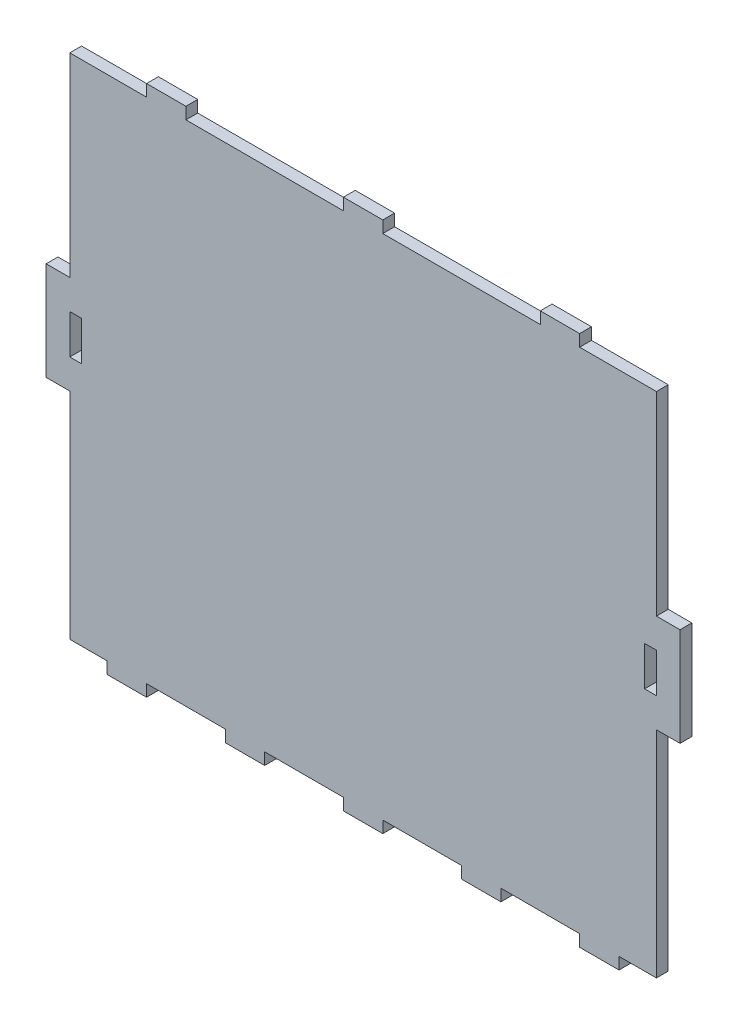
from build123d import *

# Parameters (mm, degrees)
SKETCH1_W           = 3
SKETCH1_H           = 10
BOSS_EXTRUDE1_DEPTH = 3


with BuildPart() as part:
    # Sketch1 → Boss-Extrude1 (new body)
    with BuildSketch(Plane.XY):
        Polygon((-74.5, 61.9), (-55, 61.9), (-55, 64.9), (-45, 64.9), (-45, 61.9), (-5, 61.9), (-5, 64.9), (5, 64.9), (5, 61.9), (45, 61.9), (45, 64.9), (55, 64.9), (55, 61.9), (74.5, 61.9), (74.5, 12.5), (80.5, 12.5), (80.5, -12.5), (74.5, -12.5), (74.5, -67.1), (65, -67.1), (65, -70.1), (55, -70.1), (55, -67.1), (35, -67.1), (35, -70.1), (25, -70.1), (25, -67.1), (5, -67.1), (5, -70.1), (-5, -70.1), (-5, -67.1), (-25, -67.1), (-25, -70.1), (-35, -70.1), (-35, -67.1), (-55, -67.1), (-55, -70.1), (-65, -70.1), (-65, -67.1), (-74.5, -67.1), (-74.5, -12.5), (-80.5, -12.5), (-80.5, 12.5), (-74.5, 12.5), align=None)
        with Locations((73, 0)):
            Rectangle(SKETCH1_W, SKETCH1_H, mode=Mode.SUBTRACT)
        with Locations((-73, 0)):
            Rectangle(SKETCH1_W, SKETCH1_H, mode=Mode.SUBTRACT)
    extrude(amount=BOSS_EXTRUDE1_DEPTH)


solid = part.part
